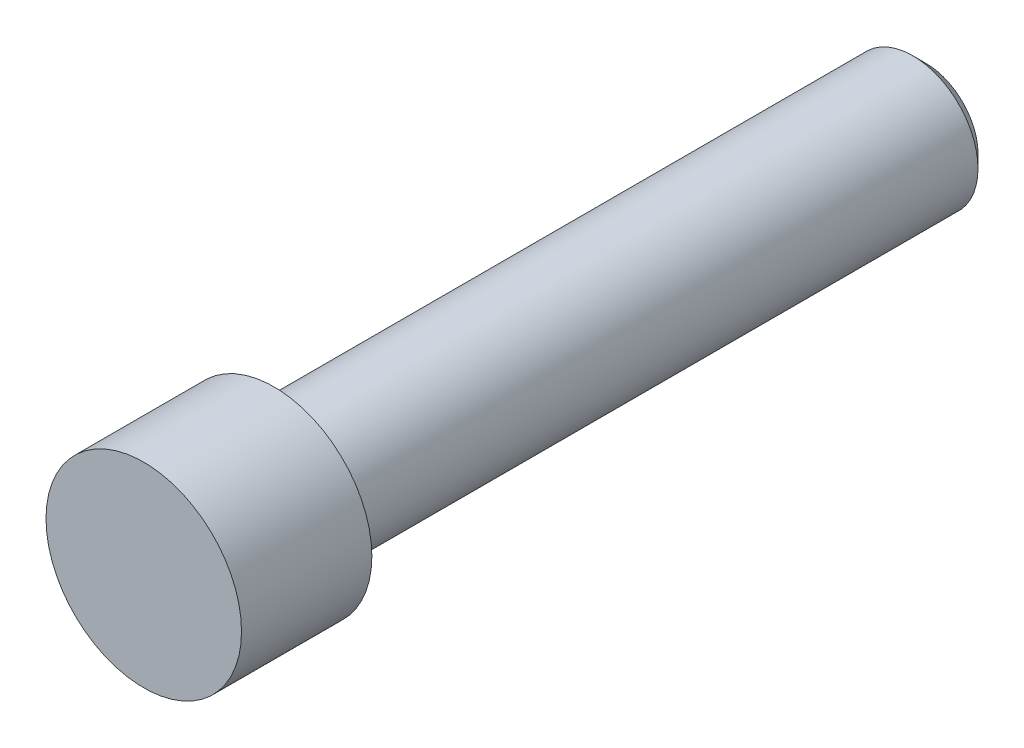
from build123d import *

# Parameters (mm, degrees)
CROQUIS1_R              = 1
SALIENTE_EXTRUIR1_DEPTH = 10
CHAFL_N1_SIZE           = 0.2
CROQUIS2_R              = 1.5
SALIENTE_EXTRUIR2_DEPTH = 2


with BuildPart() as part:
    # Croquis1 → Saliente-Extruir1 (new body)
    with BuildSketch(Plane.XY):
        Circle(CROQUIS1_R)
    extrude(amount=SALIENTE_EXTRUIR1_DEPTH)

    # Chaflán1
    chafl_n1_edges = [part.edges().sort_by_distance(p)[0] for p in [
        (-1, 0, 0),
    ]]
    chamfer(chafl_n1_edges, length=CHAFL_N1_SIZE)

    # Croquis2 → Saliente-Extruir2 (add)
    with BuildSketch(Plane.XY.offset(10)):
        Circle(CROQUIS2_R)
    extrude(amount=SALIENTE_EXTRUIR2_DEPTH)


solid = part.part
